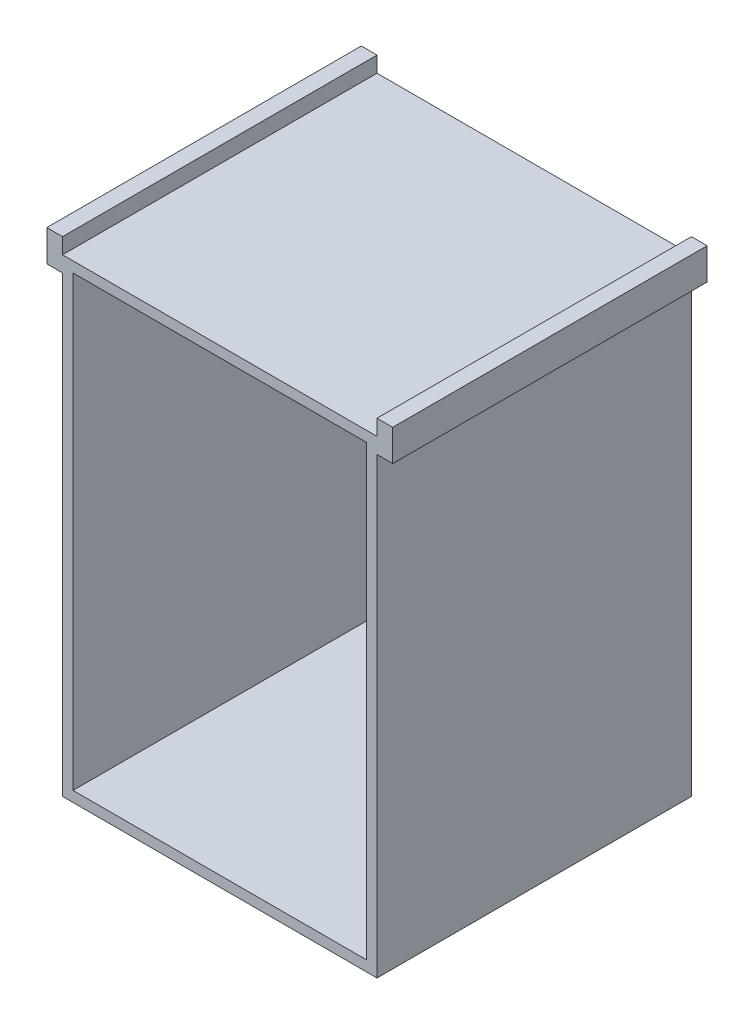
from build123d import *

# Parameters (mm, degrees)
SKETCH2_W                = 60
SKETCH2_H                = 60
BOSS_EXTRUDE1_DEPTH      = 89.5
SKETCH3_W                = 56
SKETCH3_H                = 85.5
CUT_EXTRUDE1_DEPTH       = 60
BOSS_EXTRUDE2_DEPTH      = 3
BOSS_EXTRUDE2_DEPTH_BACK = 3
SKETCH4_W                = 3
SKETCH4_H                = 60


with BuildPart() as part:
    # Sketch2 → Boss-Extrude1 (new body)
    with BuildSketch(Plane(origin=(0, 0, 0), x_dir=(1, 0, 0), z_dir=(0, 1, 0))):
        with Locations((-70.647761504, 24.591630357)):
            Rectangle(SKETCH2_W, SKETCH2_H)
    extrude(amount=BOSS_EXTRUDE1_DEPTH)

    # Sketch3 → Cut-Extrude1 (cut)
    with BuildSketch(Plane.XY.offset(5.408369643)):
        with Locations((-70.647761504, 44.75)):
            Rectangle(SKETCH3_W, SKETCH3_H)
    extrude(amount=-CUT_EXTRUDE1_DEPTH, mode=Mode.SUBTRACT)

    # Sketch4 → Boss-Extrude2 (add, two sides: drawn at the far end of the back side and taken through both)
    with BuildSketch(Plane(origin=(0, 89.5, 0), x_dir=(1, 0, 0), z_dir=(0, 1, 0)).offset(-BOSS_EXTRUDE2_DEPTH_BACK)):
        with Locations((-102.147761504, 24.591630357)):
            Rectangle(SKETCH4_W, SKETCH4_H)
        with Locations((-39.147761504, 24.591630357)):
            Rectangle(SKETCH4_W, SKETCH4_H)
    extrude(amount=BOSS_EXTRUDE2_DEPTH + BOSS_EXTRUDE2_DEPTH_BACK)


solid = part.part
